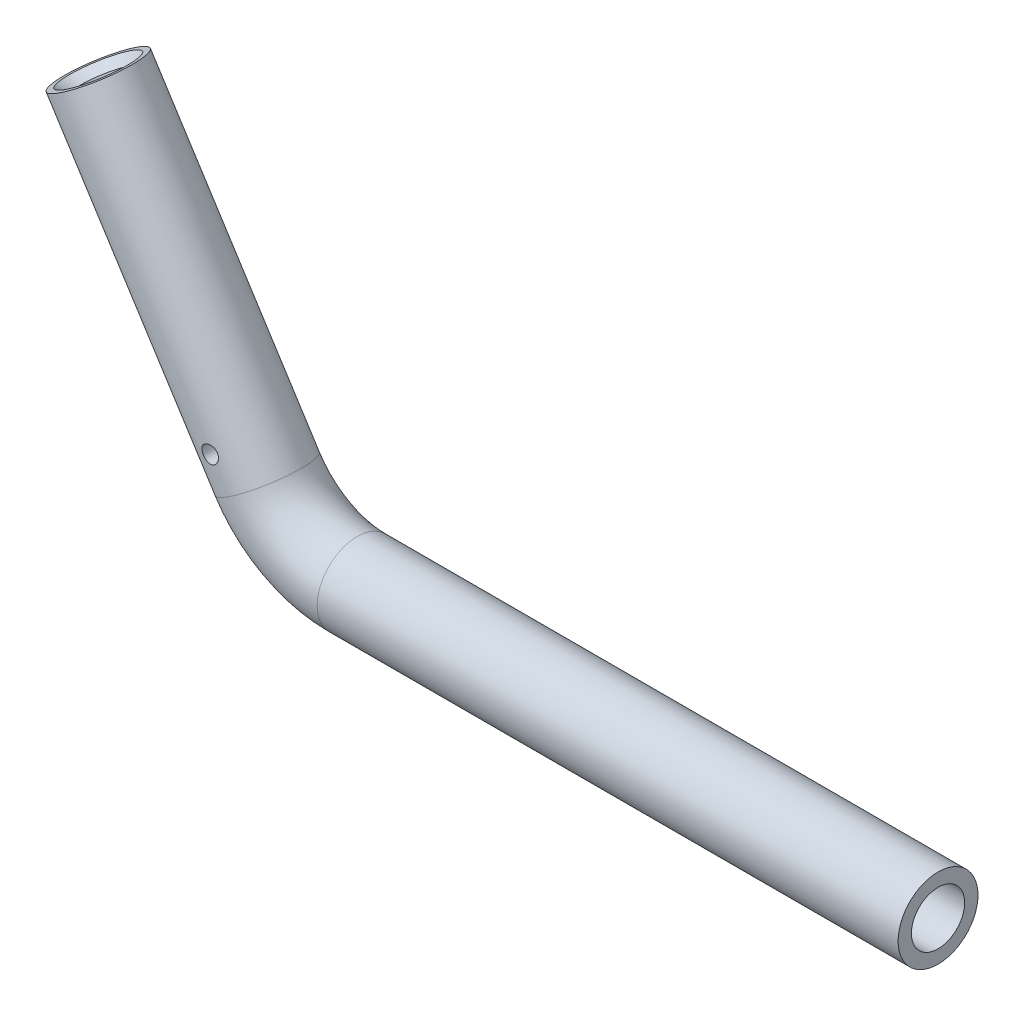
from build123d import *

# Parameters (mm, degrees)
SWEEP1_PROFILE_R        = 19.05
CUT_SWEEP1_PROFILE_R    = 12.7
CUT_EXTRUDE1_DEPTH      = 345.85787932
CUT_EXTRUDE1_DEPTH_BACK = 345.85787932
SKETCH46_R              = 3.937
CHAMFER3_SIZE           = 3.556
CHAMFER3_SIZE2          = 4.237875775


with BuildPart() as part:
    # Sweep1: sweep along a path in Sketch1
    with BuildLine(Plane.XY) as sweep1_path:
        Line((304.8, 0), (27.869834361, 0))
        ThreePointArc((27.869834361, 0), (3.4356049, 6.26228081), (-14.974451087, 23.505179896))
        Line((-14.974451087, 23.505179896), (-95.531870364, 149.954999066))
    # Sweep1 profile (on start of the path) → Sweep1 (sweep)
    with BuildSketch(Plane(origin=(304.8, 0, 0), x_dir=(0, 0, -1), z_dir=(-1, 0, 0))):
        Circle(SWEEP1_PROFILE_R)
    sweep(path=sweep1_path.line)

    # Cut-Sweep1: sweep along a path in Sketch1<2>
    with BuildLine(Plane.XY) as cut_sweep1_path:
        Line((304.8, 0), (27.869834361, 0))
        ThreePointArc((27.869834361, 0), (3.4356049, 6.26228081), (-14.974451087, 23.505179896))
        Line((-14.974451087, 23.505179896), (-95.531870364, 149.954999066))
    # Cut-Sweep1 profile (on start of the path) → Cut-Sweep1 (sweep, cut)
    with BuildSketch(Plane(origin=(304.8, 0, 0), x_dir=(0, 0, -1), z_dir=(-1, 0, 0))):
        Circle(CUT_SWEEP1_PROFILE_R)
    sweep(path=cut_sweep1_path.line, mode=Mode.SUBTRACT)

    # Sketch46 → Cut-Extrude1 (cut, two sides: drawn at the far end of the back side and taken through both)
    with BuildSketch(Plane.XY.offset(-CUT_EXTRUDE1_DEPTH_BACK)):
        with Locations((-23.435845319, 36.786908385)):
            Circle(SKETCH46_R)
    extrude(amount=CUT_EXTRUDE1_DEPTH + CUT_EXTRUDE1_DEPTH_BACK, mode=Mode.SUBTRACT)

    # Chamfer3
    chamfer3_edges = [part.edges().sort_by_distance(p)[0] for p in [
        (-95.531870364, 149.954999066, 12.7),
    ]]
    chamfer3_side = [part.faces().sort_by_distance(p)[0] for p in [
        (-95.531870364, 149.954999066, 18.511184633),
    ]]
    chamfer(chamfer3_edges, length=CHAMFER3_SIZE, length2=CHAMFER3_SIZE2, reference=chamfer3_side[0])


solid = part.part
